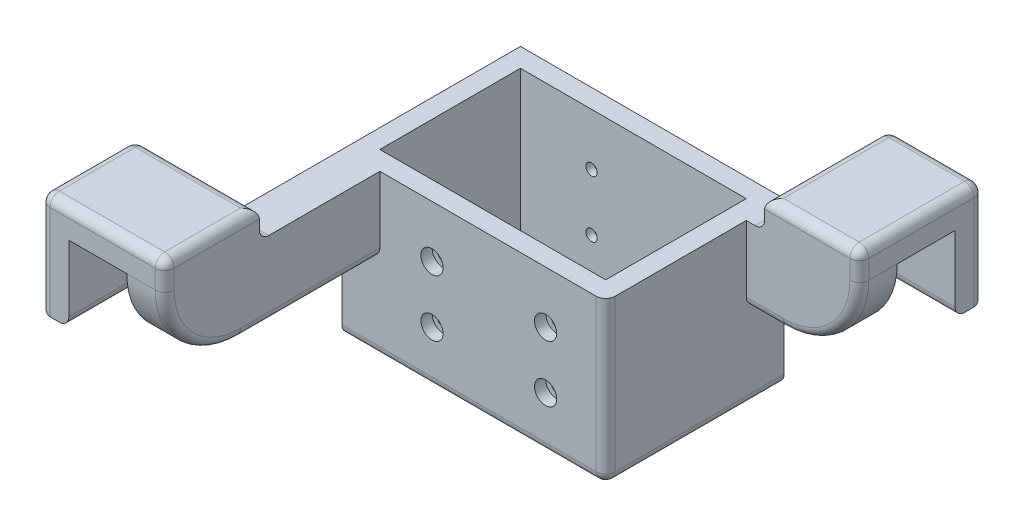
from build123d import *

# Parameters (mm, degrees)
SKETCH23_W            = 55.7
SKETCH23_H            = 37.7
SKETCH23_W_2          = 47.7
SKETCH23_H_2          = 29.7
BOSS_EXTRUDE11_DEPTH  = 34.1
BOSS_EXTRUDE3_DEPTH   = 6
BOSS_EXTRUDE3_2_DEPTH = 6
SKETCH19_W            = 6
SKETCH19_H            = 20
SKETCH19_W_2          = 20
SKETCH19_H_2          = 6
SKETCH19_W_3          = 8
SKETCH19_H_3          = 45.451128654
SKETCH19_W_4          = 23.872388302
SKETCH19_H_4          = 8
BOSS_EXTRUDE10_DEPTH  = 16
FILLET6_R             = 16
FILLET7_R             = 2
SKETCH11_R            = 1.2
CUT_EXTRUDE1_DEPTH    = 121.03618278
SKETCH21_R            = 2.35
CUT_EXTRUDE2_DEPTH    = 2.4
CUT_EXTRUDE3_START    = -2.4
SKETCH22_R            = 2.35
CUT_EXTRUDE3_DEPTH    = 2.4


with BuildPart() as part:
    # Sketch23 → Boss-Extrude11 (new body)
    with BuildSketch(Plane(origin=(0, 0, 0), x_dir=(1, 0, 0), z_dir=(0, 1, 0))):
        with Locations((27.85, -18.85)):
            Rectangle(SKETCH23_W, SKETCH23_H)
        with Locations((27.85, -18.85)):
            Rectangle(SKETCH23_W_2, SKETCH23_H_2, mode=Mode.SUBTRACT)
    extrude(amount=-BOSS_EXTRUDE11_DEPTH)



with BuildPart() as body_2:
    # Sketch12 → Boss-Extrude3 (new body)
    with BuildSketch(Plane(origin=(0, 0, 0), x_dir=(1, 0, 0), z_dir=(0, 1, 0))):
        Polygon((0, -83.151128654), (-12.2428, -83.151128654), (-18.2428, -83.151128654), (-18.2428, -63.151128654), (-12.2428, -63.151128654), (0, -63.151128654), (8, -63.151128654), (8, -83.151128654), align=None)
    extrude(amount=BOSS_EXTRUDE3_DEPTH)


with BuildPart() as body_3:
    # Sketch12 → Boss-Extrude3 2 (new body)
    with BuildSketch(Plane(origin=(0, 0, 0), x_dir=(1, 0, 0), z_dir=(0, 1, 0))):
        Polygon((59.572388302, -8), (59.572388302, 0), (59.572388302, 12.2428), (59.572388302, 18.2428), (79.572388302, 18.2428), (79.572388302, 12.2428), (79.572388302, 0), (79.572388302, -8), align=None)
    extrude(amount=BOSS_EXTRUDE3_2_DEPTH)


with BuildPart() as part_1:
    add(part.part)

    add(body_2.part)  # Boss-Extrude10 merges body 2

    add(body_3.part)  # Boss-Extrude10 merges body 3
    # Sketch19 → Boss-Extrude10 (add)
    with BuildSketch(Plane(origin=(0, 0, 0), x_dir=(1, 0, 0), z_dir=(0, 1, 0))):
        with Locations((-15.2428, -73.151128654)):
            Rectangle(SKETCH19_W, SKETCH19_H)
        with Locations((69.572388302, 15.2428)):
            Rectangle(SKETCH19_W_2, SKETCH19_H_2)
        with Locations((4, -60.425564327)):
            Rectangle(SKETCH19_W_3, SKETCH19_H_3)
        with Locations((67.636194151, -4)):
            Rectangle(SKETCH19_W_4, SKETCH19_H_4)
    extrude(amount=-BOSS_EXTRUDE10_DEPTH)

    # Fillet6
    fillet6_edges = [part_1.edges().sort_by_distance(p)[0] for p in [
        (79.572388302, -16, 4),
        (4, -16, 83.151128654),
    ]]
    fillet(fillet6_edges, radius=FILLET6_R)

    # Fillet7
    fillet7_edges = [part_1.edges().sort_by_distance(p)[0] for p in [
        (74.886096801, -11.313708499, 8),
        (8, 3, 83.151128654),
        (8, -16, 52.425564327),
        (8, -11.313708499, 78.464837153),
        (55.7, -34.1, 18.85),
        (4, 0, 63.151128654),
        (-18.2428, -5, 63.151128654),
        (-18.2428, -5, 83.151128654),
        (8, 6, 73.151128654),
        (-5.1214, 6, 63.151128654),
        (-18.2428, 6, 73.151128654),
        (-5.1214, 6, 83.151128654),
        (59.636194151, -16, 8),
        (79.572388302, -5, -18.2428),
        (59.572388302, 0, 4),
        (59.572388302, -5, -18.2428),
        (69.572388302, 6, 8),
        (79.572388302, 6, -5.1214),
        (69.572388302, 6, -18.2428),
        (59.572388302, 6, -5.1214),
        (-18.2428, -16, 73.151128654),
        (-12.2428, -16, 73.151128654),
        (55.7, -17.05, 37.7),
        (69.572388302, -16, -18.2428),
        (69.572388302, -16, -12.2428),
        (27.85, -34.1, 37.7),
        (79.572388302, 3, 8),
    ]]
    fillet(fillet7_edges, radius=FILLET7_R)

    # Sketch11 → Cut-Extrude1 (cut, through all)
    with BuildSketch(Plane(origin=(0, 0, 0), x_dir=(-1, 0, 0), z_dir=(0, 0, -1))):
        with Locations(Location((-19.011079079, -11, 0), (0, 0, 180))):
            Circle(SKETCH11_R)
        with Locations(Location((-19.011079079, -23, 0), (0, 0, 180))):
            Circle(SKETCH11_R)
        with Locations(Location((-43.01107908, -11, 0), (0, 0, 180))):
            Circle(SKETCH11_R)
        with Locations(Location((-43.011079079, -23, 0), (0, 0, 180))):
            Circle(SKETCH11_R)
    extrude(amount=-CUT_EXTRUDE1_DEPTH, mode=Mode.SUBTRACT)

    # Sketch21 → Cut-Extrude2 (cut)
    with BuildSketch(Plane.XY.offset(37.7)):
        with Locations((19.011079079, -11)):
            Circle(SKETCH21_R)
        with Locations((43.01107908, -11)):
            Circle(SKETCH21_R)
        with Locations((19.011079079, -23)):
            Circle(SKETCH21_R)
        with Locations((43.011079079, -23)):
            Circle(SKETCH21_R)
    extrude(amount=-CUT_EXTRUDE2_DEPTH, mode=Mode.SUBTRACT)

    # Sketch22 → Cut-Extrude3 (cut)
    with BuildSketch(Plane(origin=(0, 0, 0), x_dir=(-1, 0, 0), z_dir=(0, 0, -1)).offset(CUT_EXTRUDE3_START)):
        with Locations(Location((-43.01107908, -11, 0), (0, 0, 180))):
            Circle(SKETCH22_R)
        with Locations(Location((-43.011079079, -23, 0), (0, 0, 180))):
            Circle(SKETCH22_R)
        with Locations(Location((-19.011079079, -11, 0), (0, 0, 180))):
            Circle(SKETCH22_R)
        with Locations(Location((-19.011079079, -23, 0), (0, 0, 180))):
            Circle(SKETCH22_R)
    extrude(amount=CUT_EXTRUDE3_DEPTH, mode=Mode.SUBTRACT)


solid = part_1.part
